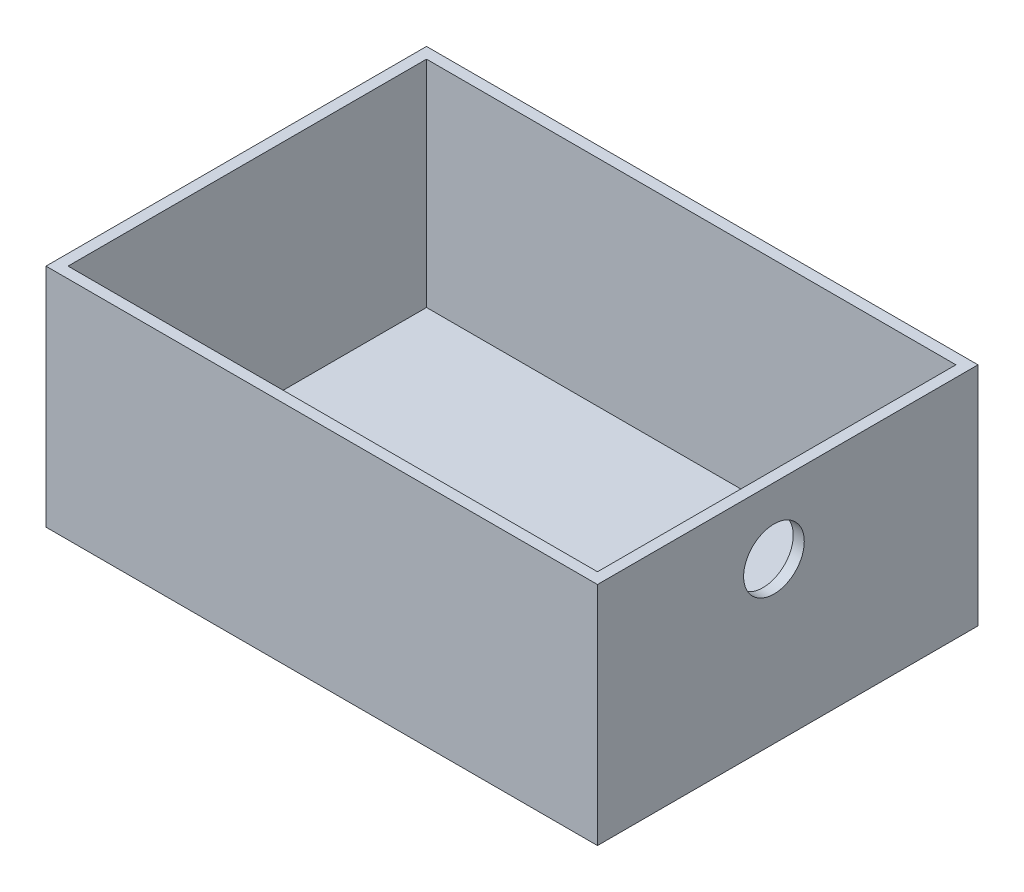
from build123d import *

# Parameters (mm, degrees)
SKETCH1_W           = 100
SKETCH1_H           = 69
BOSS_EXTRUDE1_DEPTH = 41
SKETCH3_W           = 96
SKETCH3_H           = 65
CUT_EXTRUDE2_DEPTH  = 39
SKETCH4_W           = 6
SKETCH4_H           = 6
CUT_EXTRUDE3_DEPTH  = 2
SKETCH1_4_W         = 100
SKETCH1_4_H         = 69
BOSS_EXTRUDE2_DEPTH = 2
SKETCH6_R           = 5.5
CUT_EXTRUDE4_DEPTH  = 2


with BuildPart() as part:
    # Sketch1 → Boss-Extrude1 (new body)
    with BuildSketch(Plane(origin=(0, 0, 0), x_dir=(1, 0, 0), z_dir=(0, 1, 0))):
        Rectangle(SKETCH1_W, SKETCH1_H)
    extrude(amount=BOSS_EXTRUDE1_DEPTH)

    # Sketch3 → Cut-Extrude2 (cut)
    with BuildSketch(Plane(origin=(0, 41, 0), x_dir=(1, 0, 0), z_dir=(0, 1, 0))):
        Rectangle(SKETCH3_W, SKETCH3_H)
    extrude(amount=-CUT_EXTRUDE2_DEPTH, mode=Mode.SUBTRACT)

    # Sketch4 → Cut-Extrude3 (cut)
    with BuildSketch(Plane(origin=(0, 0, -34.5), x_dir=(-1, 0, 0), z_dir=(0, 0, -1))):
        with Locations((-45, 5)):
            Rectangle(SKETCH4_W, SKETCH4_H)
    extrude(amount=-CUT_EXTRUDE3_DEPTH, mode=Mode.SUBTRACT)

    # Sketch1<4> → Boss-Extrude2 (add)
    with BuildSketch(Plane(origin=(0, 0, 0), x_dir=(1, 0, 0), z_dir=(0, 1, 0))):
        Rectangle(SKETCH1_4_W, SKETCH1_4_H)
    extrude(amount=BOSS_EXTRUDE2_DEPTH)

    # Sketch6 → Cut-Extrude4 (cut)
    with BuildSketch(Plane(origin=(50, 0, 0), x_dir=(0, 0, -1), z_dir=(1, 0, 0))):
        with Locations((-2.5, 29)):
            Circle(SKETCH6_R)
    extrude(amount=-CUT_EXTRUDE4_DEPTH, mode=Mode.SUBTRACT)


solid = part.part
